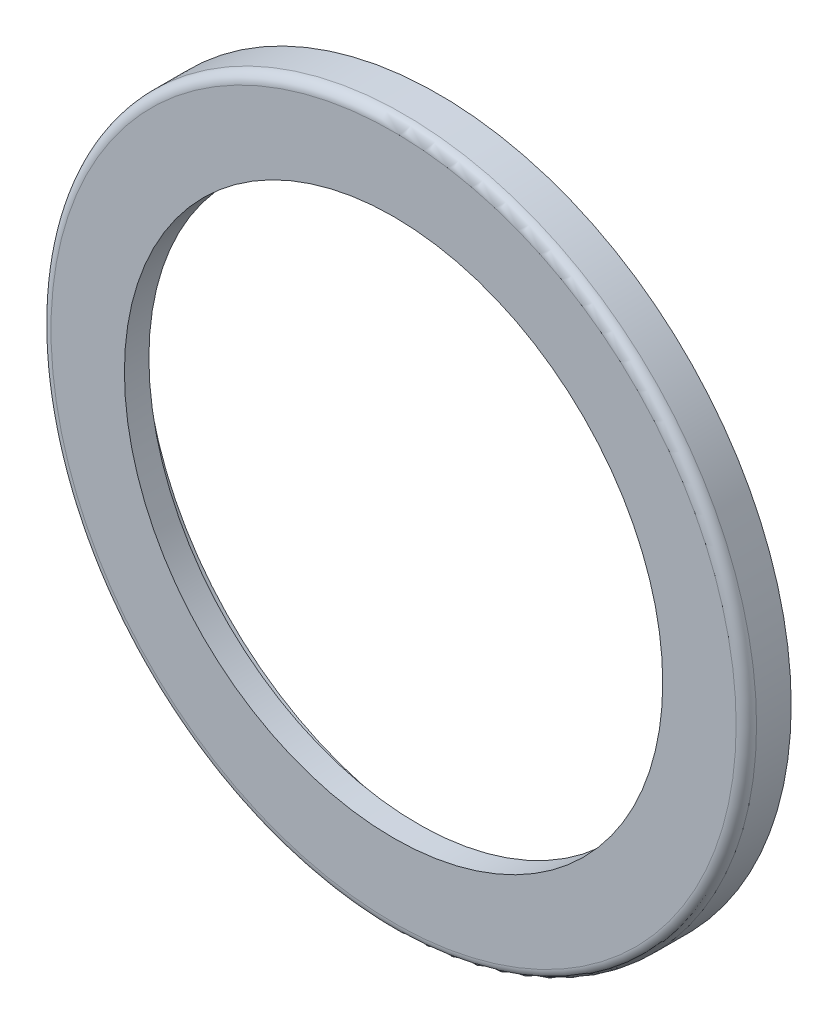
from build123d import *

# Parameters (mm, degrees)
SKETCH_1_R          = 17.3
SKETCH_1_R_2        = 13.2
EXTRUDE_1_DEPTH     = 2.2
SKETCH_2_R          = 14.394054642
CUT_EXTRUDE_1_DEPTH = 1
CUT_EXTRUDE_2_DEPTH = 1
FILLET_1_R          = 0.5


with BuildPart() as part:
    # 草图1 → 凸台-拉伸1 (new body)
    with BuildSketch(Plane.XY):
        Circle(SKETCH_1_R)
        Circle(SKETCH_1_R_2, mode=Mode.SUBTRACT)
    extrude(amount=EXTRUDE_1_DEPTH)

    # 草图2 → 切除-拉伸1 (cut)
    with BuildSketch(Plane(origin=(0, 0, 0), x_dir=(-1, 0, 0), z_dir=(0, 0, -1))):
        Circle(SKETCH_2_R)
    extrude(amount=-CUT_EXTRUDE_1_DEPTH, mode=Mode.SUBTRACT)

    # 草图3 → 切除-拉伸2 (cut)
    with BuildSketch(Plane(origin=(0, 0, 0), x_dir=(-1, 0, 0), z_dir=(0, 0, -1))):
        with BuildLine():
            Line((-2.642058299, 14.986101169), (-2.863597348, 16.242699714))
            ThreePointArc((-2.863597348, 16.242699714), (0, 16.493195075), (2.863597348, 16.242699714))
            Line((2.863597348, 16.242699714), (2.642058299, 14.986101169))
            ThreePointArc((2.642058299, 14.986101169), (0, 15.217217233), (-2.642058299, 14.986101169))
        make_face()
        with BuildLine():
            Line((10.94607932, 10.571047622), (11.863918269, 11.457439813))
            ThreePointArc((11.863918269, 11.457439813), (9.694456828, 13.343275107), (7.23052043, 14.823800393))
            Line((7.23052043, 14.823800393), (6.671139193, 13.676973429))
            ThreePointArc((6.671139193, 13.676973429), (8.94445587, 12.310987348), (10.94607932, 10.571047622))
        make_face()
        with BuildLine():
            Line((15.069070085, 2.118213179), (16.332625651, 2.295827328))
            ThreePointArc((16.332625651, 2.295827328), (15.685960651, 5.09667757), (14.56282516, 7.742713165))
            Line((14.56282516, 7.742713165), (13.436188256, 7.143706702))
            ThreePointArc((13.436188256, 7.143706702), (14.472433609, 4.702378732), (15.069070085, 2.118213179))
        make_face()
        with BuildLine():
            Line((13.436188256, -7.143706702), (14.56282516, -7.742713165))
            ThreePointArc((14.56282516, -7.742713165), (15.685960651, -5.09667757), (16.332625651, -2.295827328))
            Line((16.332625651, -2.295827328), (15.069070085, -2.118213179))
            ThreePointArc((15.069070085, -2.118213179), (14.472433609, -4.702378732), (13.436188256, -7.143706702))
        make_face()
        with BuildLine():
            Line((6.671139193, -13.676973429), (7.23052043, -14.823800393))
            ThreePointArc((7.23052043, -14.823800393), (9.694456828, -13.343275107), (11.863918269, -11.457439813))
            Line((11.863918269, -11.457439813), (10.94607932, -10.571047622))
            ThreePointArc((10.94607932, -10.571047622), (8.94445587, -12.310987348), (6.671139193, -13.676973429))
        make_face()
        with BuildLine():
            Line((-2.642058299, -14.986101169), (-2.863597348, -16.242699714))
            ThreePointArc((-2.863597348, -16.242699714), (0, -16.493195075), (2.863597348, -16.242699714))
            Line((2.863597348, -16.242699714), (2.642058299, -14.986101169))
            ThreePointArc((2.642058299, -14.986101169), (0, -15.217217233), (-2.642058299, -14.986101169))
        make_face()
        with BuildLine():
            Line((-10.94607932, -10.571047622), (-11.863918269, -11.457439813))
            ThreePointArc((-11.863918269, -11.457439813), (-9.694456828, -13.343275107), (-7.23052043, -14.823800393))
            Line((-7.23052043, -14.823800393), (-6.671139193, -13.676973429))
            ThreePointArc((-6.671139193, -13.676973429), (-8.94445587, -12.310987348), (-10.94607932, -10.571047622))
        make_face()
        with BuildLine():
            Line((-15.069070085, -2.118213179), (-16.332625651, -2.295827328))
            ThreePointArc((-16.332625651, -2.295827328), (-15.685960651, -5.09667757), (-14.56282516, -7.742713165))
            Line((-14.56282516, -7.742713165), (-13.436188256, -7.143706702))
            ThreePointArc((-13.436188256, -7.143706702), (-14.472433609, -4.702378732), (-15.069070085, -2.118213179))
        make_face()
        with BuildLine():
            Line((-13.436188256, 7.143706702), (-14.56282516, 7.742713165))
            ThreePointArc((-14.56282516, 7.742713165), (-15.685960651, 5.09667757), (-16.332625651, 2.295827328))
            Line((-16.332625651, 2.295827328), (-15.069070085, 2.118213179))
            ThreePointArc((-15.069070085, 2.118213179), (-14.472433609, 4.702378732), (-13.436188256, 7.143706702))
        make_face()
        with BuildLine():
            Line((-6.671139193, 13.676973429), (-7.23052043, 14.823800393))
            ThreePointArc((-7.23052043, 14.823800393), (-9.694456828, 13.343275107), (-11.863918269, 11.457439813))
            Line((-11.863918269, 11.457439813), (-10.94607932, 10.571047622))
            ThreePointArc((-10.94607932, 10.571047622), (-8.94445587, 12.310987348), (-6.671139193, 13.676973429))
        make_face()
    extrude(amount=-CUT_EXTRUDE_2_DEPTH, mode=Mode.SUBTRACT)

    # 圆角1
    fillet_1_edges = [part.edges().sort_by_distance(p)[0] for p in [
        (-17.3, 0, 2.2),
    ]]
    fillet(fillet_1_edges, radius=FILLET_1_R)


solid = part.part
